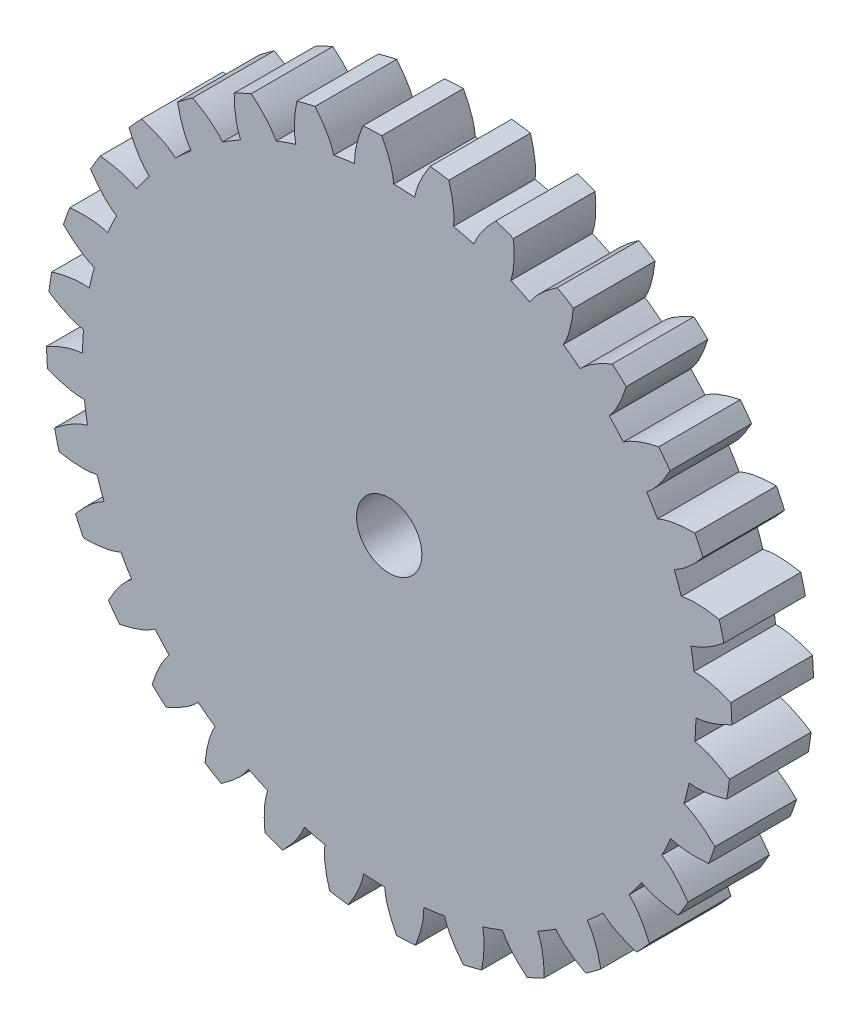
from build123d import *

# Parameters (mm, degrees)
BOSS_EXTRUDE7_DEPTH = 1
CIRPATTERN1_COUNT   = 32
DIAMETRO_BASE_R     = 3.758770483
BOSS_EXTRUDE9_DEPTH = 1
MOZZO_R             = 0.4
CUT_EXTRUDE1_DEPTH  = 1
SKETCH1_R           = 4.25
SKETCH1_R_2         = 4.2
CUT_EXTRUDE2_DEPTH  = 7.090787907


with BuildPart() as part:
    # profilo → Boss-Extrude7 (new body)
    with BuildSketch(Plane.XY):
        with BuildLine():
            Line((-0.208537616, 4.244880689), (-0.184434126, 3.754242879))
            ThreePointArc((-0.184434126, 3.754242879), (-0.064239901, 3.758221492), (0.056020084, 3.758353003))
            add(Edge.make_bspline(
                [(-0.116842984, 4.248393545), (-0.034075941, 4.096076065), (0.042378759, 3.933500457), (0.056020084, 3.758353003)],
                knots=[0.080011926, 0.080011926, 0.080011926, 0.080011926, 1, 1, 1, 1], degree=3))
            ThreePointArc((-0.116842984, 4.248393545), (-0.162699781, 4.246884597), (-0.208537616, 4.244880689))
        make_face()
    extrude(amount=BOSS_EXTRUDE7_DEPTH)

    # Mirror1: part across plane


with BuildPart() as part_1:
    add(part.part)
    add(part.part.mirror(Plane(origin=(0, 0, 0), x_dir=(0, 0, 1), z_dir=(0.9987954562051725, 0.0490676743274181, 0))))


with BuildPart() as cirpattern1_1:
    # CirPattern1: pattern copy
    add(part_1.part.rotate(Axis((0, 0, 0), (0, 0, -1)), 1 * 360 / CIRPATTERN1_COUNT))


with BuildPart() as cirpattern1_2:
    # CirPattern1: pattern copy
    add(part_1.part.rotate(Axis((0, 0, 0), (0, 0, -1)), 2 * 360 / CIRPATTERN1_COUNT))


with BuildPart() as cirpattern1_3:
    # CirPattern1: pattern copy
    add(part_1.part.rotate(Axis((0, 0, 0), (0, 0, -1)), 3 * 360 / CIRPATTERN1_COUNT))


with BuildPart() as cirpattern1_4:
    # CirPattern1: pattern copy
    add(part_1.part.rotate(Axis((0, 0, 0), (0, 0, -1)), 4 * 360 / CIRPATTERN1_COUNT))


with BuildPart() as cirpattern1_5:
    # CirPattern1: pattern copy
    add(part_1.part.rotate(Axis((0, 0, 0), (0, 0, -1)), 5 * 360 / CIRPATTERN1_COUNT))


with BuildPart() as cirpattern1_6:
    # CirPattern1: pattern copy
    add(part_1.part.rotate(Axis((0, 0, 0), (0, 0, -1)), 6 * 360 / CIRPATTERN1_COUNT))


with BuildPart() as cirpattern1_7:
    # CirPattern1: pattern copy
    add(part_1.part.rotate(Axis((0, 0, 0), (0, 0, -1)), 7 * 360 / CIRPATTERN1_COUNT))


with BuildPart() as cirpattern1_8:
    # CirPattern1: pattern copy
    add(part_1.part.rotate(Axis((0, 0, 0), (0, 0, -1)), 8 * 360 / CIRPATTERN1_COUNT))


with BuildPart() as cirpattern1_9:
    # CirPattern1: pattern copy
    add(part_1.part.rotate(Axis((0, 0, 0), (0, 0, -1)), 9 * 360 / CIRPATTERN1_COUNT))


with BuildPart() as cirpattern1_10:
    # CirPattern1: pattern copy
    add(part_1.part.rotate(Axis((0, 0, 0), (0, 0, -1)), 10 * 360 / CIRPATTERN1_COUNT))


with BuildPart() as cirpattern1_11:
    # CirPattern1: pattern copy
    add(part_1.part.rotate(Axis((0, 0, 0), (0, 0, -1)), 11 * 360 / CIRPATTERN1_COUNT))


with BuildPart() as cirpattern1_12:
    # CirPattern1: pattern copy
    add(part_1.part.rotate(Axis((0, 0, 0), (0, 0, -1)), 12 * 360 / CIRPATTERN1_COUNT))


with BuildPart() as cirpattern1_13:
    # CirPattern1: pattern copy
    add(part_1.part.rotate(Axis((0, 0, 0), (0, 0, -1)), 13 * 360 / CIRPATTERN1_COUNT))


with BuildPart() as cirpattern1_14:
    # CirPattern1: pattern copy
    add(part_1.part.rotate(Axis((0, 0, 0), (0, 0, -1)), 14 * 360 / CIRPATTERN1_COUNT))


with BuildPart() as cirpattern1_15:
    # CirPattern1: pattern copy
    add(part_1.part.rotate(Axis((0, 0, 0), (0, 0, -1)), 15 * 360 / CIRPATTERN1_COUNT))


with BuildPart() as cirpattern1_16:
    # CirPattern1: pattern copy
    add(part_1.part.rotate(Axis((0, 0, 0), (0, 0, -1)), 16 * 360 / CIRPATTERN1_COUNT))


with BuildPart() as cirpattern1_17:
    # CirPattern1: pattern copy
    add(part_1.part.rotate(Axis((0, 0, 0), (0, 0, -1)), 17 * 360 / CIRPATTERN1_COUNT))


with BuildPart() as cirpattern1_18:
    # CirPattern1: pattern copy
    add(part_1.part.rotate(Axis((0, 0, 0), (0, 0, -1)), 18 * 360 / CIRPATTERN1_COUNT))


with BuildPart() as cirpattern1_19:
    # CirPattern1: pattern copy
    add(part_1.part.rotate(Axis((0, 0, 0), (0, 0, -1)), 19 * 360 / CIRPATTERN1_COUNT))


with BuildPart() as cirpattern1_20:
    # CirPattern1: pattern copy
    add(part_1.part.rotate(Axis((0, 0, 0), (0, 0, -1)), 20 * 360 / CIRPATTERN1_COUNT))


with BuildPart() as cirpattern1_21:
    # CirPattern1: pattern copy
    add(part_1.part.rotate(Axis((0, 0, 0), (0, 0, -1)), 21 * 360 / CIRPATTERN1_COUNT))


with BuildPart() as cirpattern1_22:
    # CirPattern1: pattern copy
    add(part_1.part.rotate(Axis((0, 0, 0), (0, 0, -1)), 22 * 360 / CIRPATTERN1_COUNT))


with BuildPart() as cirpattern1_23:
    # CirPattern1: pattern copy
    add(part_1.part.rotate(Axis((0, 0, 0), (0, 0, -1)), 23 * 360 / CIRPATTERN1_COUNT))


with BuildPart() as cirpattern1_24:
    # CirPattern1: pattern copy
    add(part_1.part.rotate(Axis((0, 0, 0), (0, 0, -1)), 24 * 360 / CIRPATTERN1_COUNT))


with BuildPart() as cirpattern1_25:
    # CirPattern1: pattern copy
    add(part_1.part.rotate(Axis((0, 0, 0), (0, 0, -1)), 25 * 360 / CIRPATTERN1_COUNT))


with BuildPart() as cirpattern1_26:
    # CirPattern1: pattern copy
    add(part_1.part.rotate(Axis((0, 0, 0), (0, 0, -1)), 26 * 360 / CIRPATTERN1_COUNT))


with BuildPart() as cirpattern1_27:
    # CirPattern1: pattern copy
    add(part_1.part.rotate(Axis((0, 0, 0), (0, 0, -1)), 27 * 360 / CIRPATTERN1_COUNT))


with BuildPart() as cirpattern1_28:
    # CirPattern1: pattern copy
    add(part_1.part.rotate(Axis((0, 0, 0), (0, 0, -1)), 28 * 360 / CIRPATTERN1_COUNT))


with BuildPart() as cirpattern1_29:
    # CirPattern1: pattern copy
    add(part_1.part.rotate(Axis((0, 0, 0), (0, 0, -1)), 29 * 360 / CIRPATTERN1_COUNT))


with BuildPart() as cirpattern1_30:
    # CirPattern1: pattern copy
    add(part_1.part.rotate(Axis((0, 0, 0), (0, 0, -1)), 30 * 360 / CIRPATTERN1_COUNT))


with BuildPart() as cirpattern1_31:
    # CirPattern1: pattern copy
    add(part_1.part.rotate(Axis((0, 0, 0), (0, 0, -1)), 31 * 360 / CIRPATTERN1_COUNT))


with BuildPart() as part_2:
    add(part_1.part)

    add(cirpattern1_1.part)  # Boss-Extrude9 merges CirPattern1_1

    add(cirpattern1_2.part)  # Boss-Extrude9 merges CirPattern1_2

    add(cirpattern1_3.part)  # Boss-Extrude9 merges CirPattern1_3

    add(cirpattern1_4.part)  # Boss-Extrude9 merges CirPattern1_4

    add(cirpattern1_5.part)  # Boss-Extrude9 merges CirPattern1_5

    add(cirpattern1_6.part)  # Boss-Extrude9 merges CirPattern1_6

    add(cirpattern1_7.part)  # Boss-Extrude9 merges CirPattern1_7

    add(cirpattern1_8.part)  # Boss-Extrude9 merges CirPattern1_8

    add(cirpattern1_9.part)  # Boss-Extrude9 merges CirPattern1_9

    add(cirpattern1_10.part)  # Boss-Extrude9 merges CirPattern1_10

    add(cirpattern1_11.part)  # Boss-Extrude9 merges CirPattern1_11

    add(cirpattern1_12.part)  # Boss-Extrude9 merges CirPattern1_12

    add(cirpattern1_13.part)  # Boss-Extrude9 merges CirPattern1_13

    add(cirpattern1_14.part)  # Boss-Extrude9 merges CirPattern1_14

    add(cirpattern1_15.part)  # Boss-Extrude9 merges CirPattern1_15

    add(cirpattern1_16.part)  # Boss-Extrude9 merges CirPattern1_16

    add(cirpattern1_17.part)  # Boss-Extrude9 merges CirPattern1_17

    add(cirpattern1_18.part)  # Boss-Extrude9 merges CirPattern1_18

    add(cirpattern1_19.part)  # Boss-Extrude9 merges CirPattern1_19

    add(cirpattern1_20.part)  # Boss-Extrude9 merges CirPattern1_20

    add(cirpattern1_21.part)  # Boss-Extrude9 merges CirPattern1_21

    add(cirpattern1_22.part)  # Boss-Extrude9 merges CirPattern1_22

    add(cirpattern1_23.part)  # Boss-Extrude9 merges CirPattern1_23

    add(cirpattern1_24.part)  # Boss-Extrude9 merges CirPattern1_24

    add(cirpattern1_25.part)  # Boss-Extrude9 merges CirPattern1_25

    add(cirpattern1_26.part)  # Boss-Extrude9 merges CirPattern1_26

    add(cirpattern1_27.part)  # Boss-Extrude9 merges CirPattern1_27

    add(cirpattern1_28.part)  # Boss-Extrude9 merges CirPattern1_28

    add(cirpattern1_29.part)  # Boss-Extrude9 merges CirPattern1_29

    add(cirpattern1_30.part)  # Boss-Extrude9 merges CirPattern1_30

    add(cirpattern1_31.part)  # Boss-Extrude9 merges CirPattern1_31
    # diametro base → Boss-Extrude9 (add)
    with BuildSketch(Plane.XY):
        Circle(DIAMETRO_BASE_R)
    extrude(amount=BOSS_EXTRUDE9_DEPTH)

    # mozzo → Cut-Extrude1 (cut)
    with BuildSketch(Plane.XY):
        Circle(MOZZO_R)
    extrude(amount=CUT_EXTRUDE1_DEPTH, mode=Mode.SUBTRACT)

    # Sketch1 → Cut-Extrude2 (cut, through all)
    with BuildSketch(Plane.XY.offset(1)):
        Circle(SKETCH1_R)
        Circle(SKETCH1_R_2, mode=Mode.SUBTRACT)
    extrude(amount=-CUT_EXTRUDE2_DEPTH, mode=Mode.SUBTRACT)


solid = part_2.part
